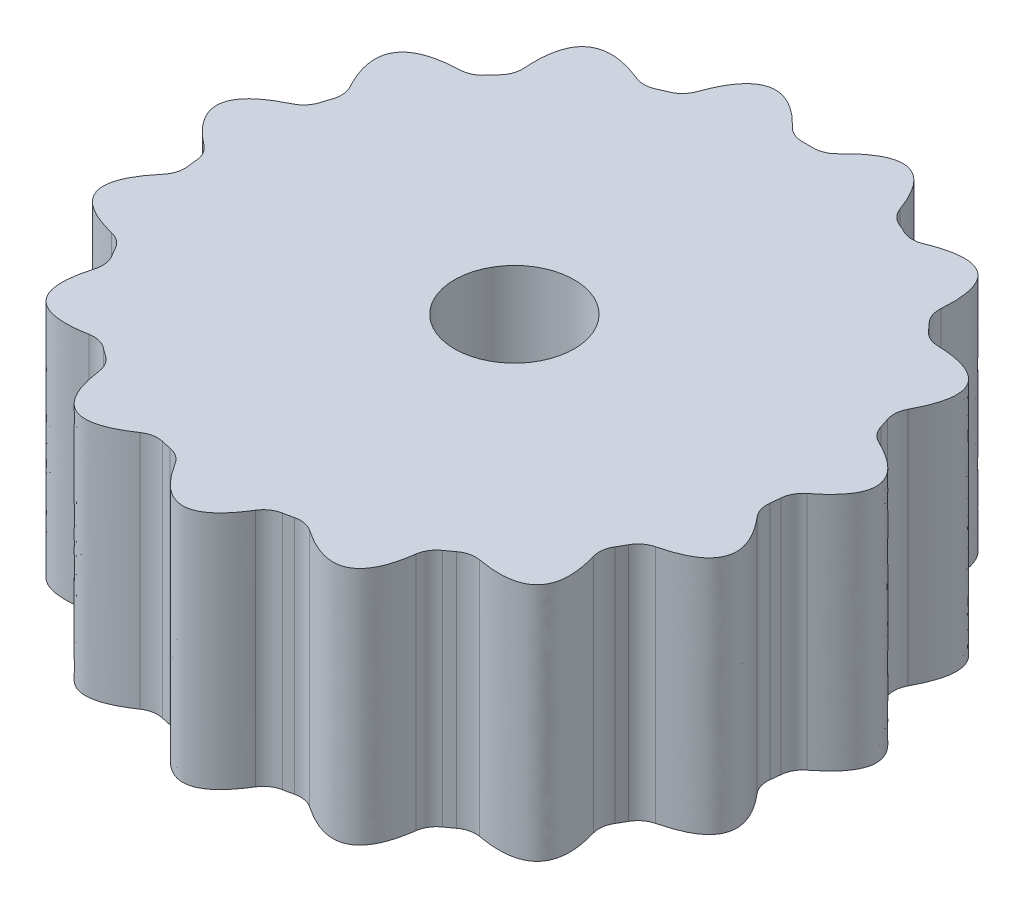
from build123d import *

# Parameters (mm, degrees)
SKETCH1_R           = 12.25
BOSS_EXTRUDE1_DEPTH = 10
BOSS_EXTRUDE2_DEPTH = 10
CIRPATTERN1_COUNT   = 15
FILLET1_R           = 1
SKETCH4_R           = 2.5
CUT_EXTRUDE1_DEPTH  = 22.935254743


with BuildPart() as part:
    # Sketch1 → Boss-Extrude1 (new body)
    with BuildSketch(Plane(origin=(0, 0, 0), x_dir=(1, 0, 0), z_dir=(0, 1, 0))):
        with Locations(Location((0, 0, 0), (0, 0, 270))):
            Circle(SKETCH1_R)
    extrude(amount=BOSS_EXTRUDE1_DEPTH)

    # Sketch3 → Boss-Extrude2 (add)
    with BuildSketch(Plane(origin=(0, 0, 0), x_dir=(1, 0, 0), z_dir=(0, 1, 0))):
        with BuildLine():
            ThreePointArc((-1.9, -12.101756071), (0, -12.25), (1.9, -12.101756071))
            add(Edge.make_bspline(
                [(-1.9, -12.101756071), (0, -15.578243929), (1.9, -12.101756071)],
                knots=[0, 0, 0, 1, 1, 1], degree=2))
        make_face()
    boss_extrude2 = extrude(amount=BOSS_EXTRUDE2_DEPTH)

    # CirPattern1: Boss-Extrude2 ×15 about axis
    cirpattern1_axis = Axis((0, 10, 0), (0, 1, 0))
    for i in range(1, CIRPATTERN1_COUNT):
        add(boss_extrude2.rotate(cirpattern1_axis, i * 360 / CIRPATTERN1_COUNT))

    # Fillet1
    fillet1_edges = [part.edges().sort_by_distance(p)[0] for p in [
        (-5.576101456, 5, -10.907318303),
        (-8.650366035, 5, -8.673734344),
        (-0.657616125, 5, -12.232335878),
        (-4.374577008, 5, -11.442271453),
        (4.374577008, 5, -11.442271453),
        (0.657616125, 5, -12.232335878),
        (8.650366035, 5, -8.673734344),
        (5.576101456, 5, -10.907318303),
        (11.430428188, 5, -4.405429768),
        (9.530428188, 5, -7.696326303),
        (12.234065465, 5, 0.624613636),
        (11.836857305, 5, -3.154569566),
        (10.922321681, 5, 5.546655669),
        (12.096586259, 5, 1.932640907),
        (7.722009251, 5, 9.509630546),
        (10.264705555, 5, 6.685680209),
        (3.18649127, 5, 11.82830391),
        (6.657964009, 5, 10.282704666),
        (-1.9, 5, 12.101756071),
        (1.9, 5, 12.101756071),
        (-6.657964009, 5, 10.282704666),
        (-3.18649127, 5, 11.82830391),
        (-10.264705555, 5, 6.685680209),
        (-7.722009251, 5, 9.509630546),
        (-12.096586259, 5, 1.932640907),
        (-10.922321681, 5, 5.546655669),
        (-11.836857305, 5, -3.154569566),
        (-12.234065465, 5, 0.624613636),
        (-9.530428188, 5, -7.696326303),
        (-11.430428188, 5, -4.405429768),
    ]]
    fillet(fillet1_edges, radius=FILLET1_R)

    # Sketch4 → Cut-Extrude1 (cut, through all)
    with BuildSketch(Plane(origin=(0, 10, 0), x_dir=(1, 0, 0), z_dir=(0, 1, 0))):
        with Locations(Location((0, 0, 0), (0, 0, 270))):
            Circle(SKETCH4_R)
    extrude(amount=-CUT_EXTRUDE1_DEPTH, mode=Mode.SUBTRACT)


solid = part.part
